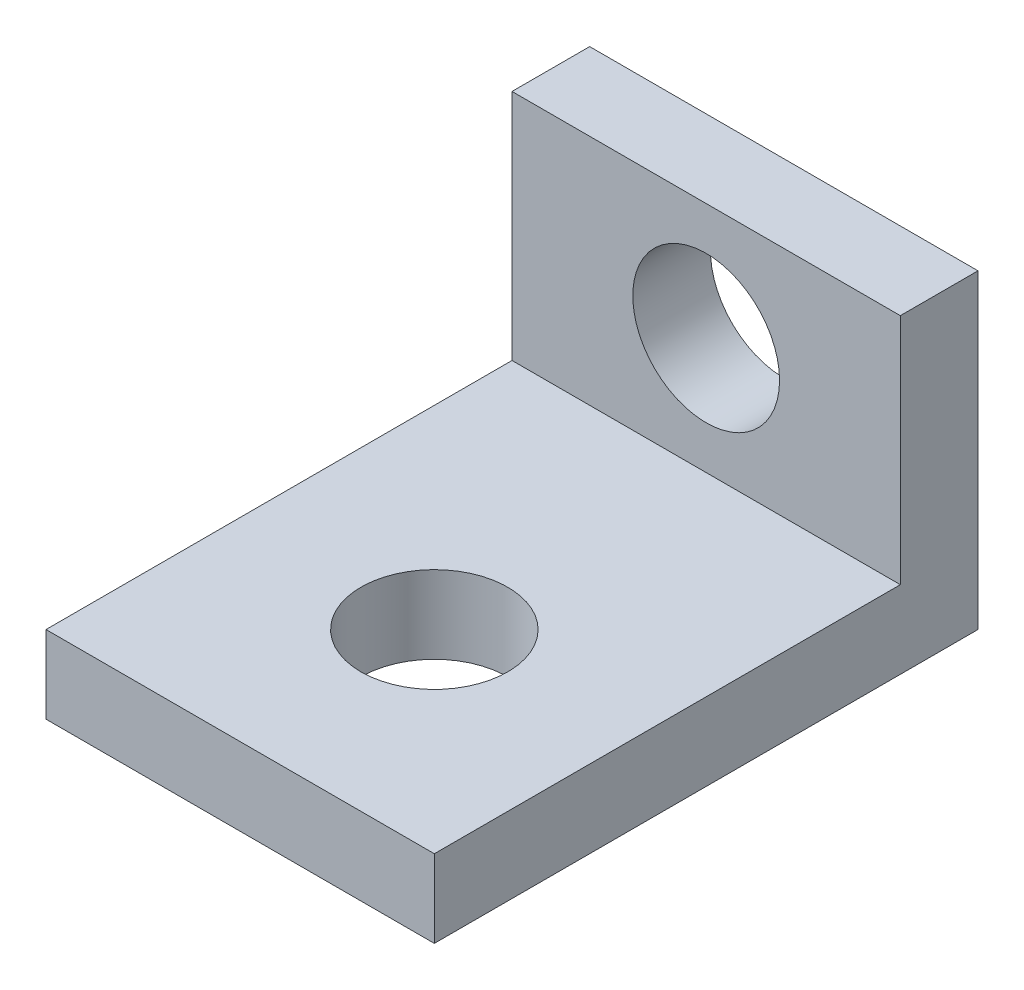
from build123d import *

# Parameters (mm, degrees)
SKETCH2_W               = 10.16
SKETCH2_H               = 10.16
BOSS_EXTRUDE1_DEPTH     = 38.1
CUT_EXTRUDE1_DEPTH      = 41.719297636
CUT_EXTRUDE1_DEPTH_BACK = 38.1
SKETCH3_W               = 7.62
SKETCH3_H               = 7.62
M4_CLEARANCE_HOLE2_D    = 4.8
SKETCH13_W              = 38.1
SKETCH13_H              = 2.54
BOSS_EXTRUDE2_DEPTH     = 7.62
M4_CLEARANCE_HOLE3_D    = 4.8
CUT_EXTRUDE2_REACH      = 45.255
SKETCH17_W              = 25.4
SKETCH17_H              = 10.16


with BuildPart() as part:
    # Sketch2 → Boss-Extrude1 (new body)
    with BuildSketch(Plane(origin=(0, 0, 0), x_dir=(0, 0, -1), z_dir=(1, 0, 0))):
        with Locations((5.08, 5.08)):
            Rectangle(SKETCH2_W, SKETCH2_H)
    extrude(amount=BOSS_EXTRUDE1_DEPTH)

    # Sketch3 → Cut-Extrude1 (cut, two sides: drawn at the far end of the back side and taken through both)
    with BuildSketch(Plane(origin=(38.1, 0, 0), x_dir=(0, 0, -1), z_dir=(1, 0, 0)).offset(-CUT_EXTRUDE1_DEPTH_BACK)):
        with Locations((3.81, 6.35)):
            Rectangle(SKETCH3_W, SKETCH3_H)
    extrude(amount=CUT_EXTRUDE1_DEPTH + CUT_EXTRUDE1_DEPTH_BACK, mode=Mode.SUBTRACT)

    # M4 Clearance Hole2 (through all)
    with Locations(Plane.XY.offset(-7.62)):
        with Locations((6.35, 6.35), (31.75, 6.35)):
            Hole(M4_CLEARANCE_HOLE2_D / 2)

    # Sketch13 → Boss-Extrude2 (add)
    with BuildSketch(Plane.XY):
        with Locations((19.05, 1.27)):
            Rectangle(SKETCH13_W, SKETCH13_H)
    extrude(amount=BOSS_EXTRUDE2_DEPTH)

    # M4 Clearance Hole3 (through all)
    with Locations(Plane(origin=(0, 2.54, 0), x_dir=(1, 0, 0), z_dir=(0, 1, 0))):
        with Locations((6.35, -1.27), (31.75, -1.27)):
            Hole(M4_CLEARANCE_HOLE3_D / 2)

    # Cut-Extrude2: up to this face of the body (flat: up to its plane)
    cut_extrude2_end = Plane(part.part.faces().sort_by_distance((19.05, 1.27, 7.62))[0])
    # Sketch17 → Cut-Extrude2 (cut, up to the picked face)
    with BuildSketch(Plane(origin=(0, 0, -10.16), x_dir=(-1, 0, 0), z_dir=(0, 0, -1)), mode=Mode.PRIVATE) as cut_extrude2_sk1:
        with Locations((-25.4, 5.08)):
            Rectangle(SKETCH17_W, SKETCH17_H)
    cut_extrude2_tool1 = split(extrude(cut_extrude2_sk1.sketch, amount=-CUT_EXTRUDE2_REACH, mode=Mode.PRIVATE), bisect_by=cut_extrude2_end, keep=Keep.BOTH, mode=Mode.PRIVATE)
    add(cut_extrude2_tool1.solids().sort_by(Axis((25.4, 5.08, -10.16), (0, 0, 1)))[0], mode=Mode.SUBTRACT)


solid = part.part
